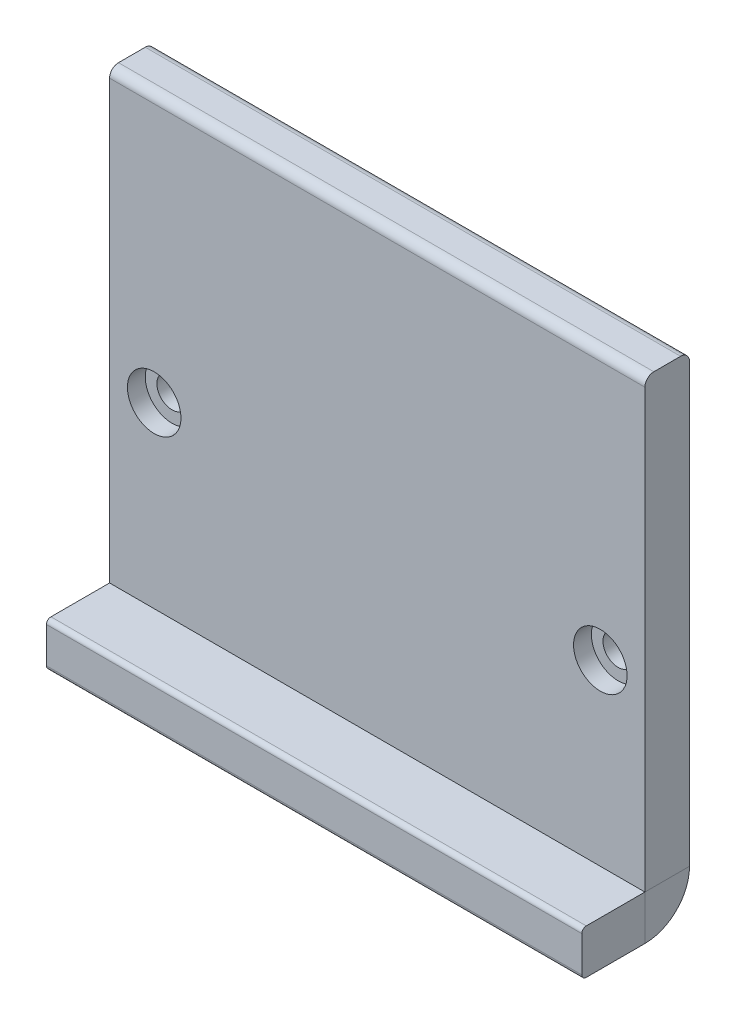
from build123d import *

# Parameters (mm, degrees)
SKETCH_1_W                = 60
SKETCH_1_H                = 50
EXTRUDE_1_DEPTH           = 5
HOLE_WIZARD_1_D           = 3.4
HOLE_WIZARD_1_DEPTH       = 7
HOLE_WIZARD_1_CBORE_D     = 6
HOLE_WIZARD_1_CBORE_DEPTH = 2
SKETCH_4_W                = 7.07
SKETCH_4_H                = 5
EXTRUDE_2_DEPTH           = 60
EXTRUDE_3_DEPTH           = 60
CUT_EXTRUDE_2_DEPTH       = 69.159261293
CUT_EXTRUDE_3_DEPTH       = 60


with BuildPart() as part:
    # 草图1 → 凸台-拉伸1 (new body)
    with BuildSketch(Plane.XY):
        Rectangle(SKETCH_1_W, SKETCH_1_H)
    extrude(amount=EXTRUDE_1_DEPTH)

    # 打孔尺寸(%根据)内六角圆柱头螺钉的类型1
    with Locations(Plane.XY.offset(5)):
        with Locations((-25, -5), (25, -5)):
            CounterBoreHole(HOLE_WIZARD_1_D / 2, HOLE_WIZARD_1_CBORE_D / 2, HOLE_WIZARD_1_CBORE_DEPTH, depth=HOLE_WIZARD_1_DEPTH)

    # 草图7 → 切除-拉伸2 (cut, through all)
    with BuildSketch(Plane.ZY.offset(30)):
        with BuildLine():
            Line((4, 25), (5, 25))
            Line((5, 25), (5, 24))
            ThreePointArc((5, 24), (4.707106781, 24.707106781), (4, 25))
        make_face()
        with BuildLine():
            Line((0, 24), (0, 25))
            Line((0, 25), (1, 25))
            ThreePointArc((1, 25), (0.292893219, 24.707106781), (0, 24))
        make_face()
    extrude(amount=-CUT_EXTRUDE_2_DEPTH, mode=Mode.SUBTRACT)


with BuildPart() as body_2:
    # 草图4 → 凸台-拉伸2 (new body)
    with BuildSketch(Plane.ZY.offset(30)):
        with Locations((8.535, -27.5)):
            Rectangle(SKETCH_4_W, SKETCH_4_H)
    extrude(amount=-EXTRUDE_2_DEPTH)

    # 草图8 → 切除-拉伸3 (cut)
    with BuildSketch(Plane.ZY.offset(30)):
        with BuildLine():
            Line((11.57, -25), (12.07, -25))
            Line((12.07, -25), (12.07, -25.5))
            ThreePointArc((12.07, -25.5), (11.923553391, -25.146446609), (11.57, -25))
        make_face()
        with BuildLine():
            Line((12.07, -29.5), (12.07, -30))
            Line((12.07, -30), (11.57, -30))
            ThreePointArc((11.57, -30), (11.923553391, -29.853553391), (12.07, -29.5))
        make_face()
    extrude(amount=-CUT_EXTRUDE_3_DEPTH, mode=Mode.SUBTRACT)


with BuildPart() as body_3:
    # 草图5 → 凸台-拉伸3 (new body)
    with BuildSketch(Plane.ZY.offset(30)):
        with BuildLine():
            Line((5, -30), (5, -25))
            Line((5, -25), (0, -25))
            ThreePointArc((0, -25), (1.464466094, -28.535533906), (5, -30))
        make_face()
    extrude(amount=-EXTRUDE_3_DEPTH)


solid = Compound([part.part, body_2.part, body_3.part])
